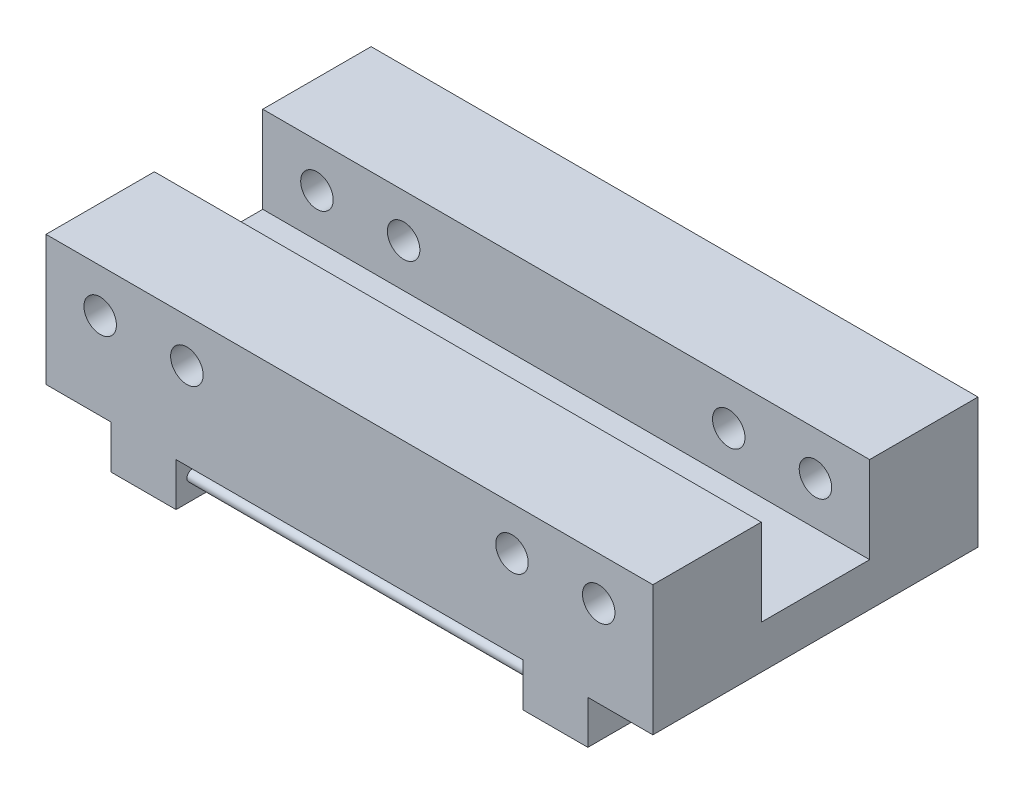
from build123d import *

# Parameters (mm, degrees)
SKETCH1_W                                  = 280
SKETCH1_H                                  = 150
BOSS_EXTRUDE1_DEPTH                        = 20
SKETCH2_W                                  = 30
SKETCH2_H                                  = 30
BOSS_EXTRUDE2_DEPTH                        = 20
MIRROR1_AT_THE_SECOND_PLANE_COPY_1_SKETC_W = 30
MIRROR1_AT_THE_SECOND_PLANE_COPY_1_SKETC_H = 30
MIRROR1_AT_THE_SECOND_PLANE_COPY_1_DEPTH   = 20
SKETCH3_R                                  = 2.5
BOSS_EXTRUDE3_DEPTH                        = 160
SKETCH7_W                                  = 280
SKETCH7_H                                  = 50
BOSS_EXTRUDE5_DEPTH                        = 40
SKETCH8_R                                  = 7.5
CUT_EXTRUDE1_DEPTH                         = 321.156211872


with BuildPart() as part:
    # Sketch1 → Boss-Extrude1 (new body)
    with BuildSketch(Plane(origin=(0, 0, 0), x_dir=(1, 0, 0), z_dir=(0, 1, 0))):
        with Locations((-140, 75)):
            Rectangle(SKETCH1_W, SKETCH1_H)
    extrude(amount=-BOSS_EXTRUDE1_DEPTH)

    # Sketch2 → Boss-Extrude2 (add)
    with BuildSketch(Plane.XZ.offset(20)):
        with Locations((-235, -15)):
            Rectangle(SKETCH2_W, SKETCH2_H)
    boss_extrude2 = extrude(amount=BOSS_EXTRUDE2_DEPTH)

    # Mirror1: Boss-Extrude2 across plane
    add(boss_extrude2.mirror(Plane.ZY.offset(140)))

    # Mirror1 at the second plane: Boss-Extrude2 across plane
    add(boss_extrude2.mirror(Plane(origin=(0, 0, -75), x_dir=(1, 0, 0), z_dir=(0, 0, -1))))

    # Mirror1 at the second plane copy 1 sketc → Mirror1 at the second plane copy 1 (add)
    with BuildSketch(Plane(origin=(-280, -20, -150), x_dir=(-1, 0, 0), z_dir=(0, -1, 0))):
        with Locations((-235, -15)):
            Rectangle(MIRROR1_AT_THE_SECOND_PLANE_COPY_1_SKETC_W, MIRROR1_AT_THE_SECOND_PLANE_COPY_1_SKETC_H)
    extrude(amount=MIRROR1_AT_THE_SECOND_PLANE_COPY_1_DEPTH)

    # Sketch3 → Boss-Extrude3 (add)
    with BuildSketch(Plane(origin=(-220, 0, 0), x_dir=(0, 0, -1), z_dir=(1, 0, 0))):
        with Locations(Location((7.5, -30, 0), (0, 0, 180))):
            Circle(SKETCH3_R)
        with Locations(Location((22.5, -30, 0), (0, 0, 180))):
            Circle(SKETCH3_R)
    boss_extrude3 = extrude(amount=BOSS_EXTRUDE3_DEPTH)

    # Mirror2: Boss-Extrude3 across plane
    add(boss_extrude3.mirror(Plane(origin=(0, 0, -75), x_dir=(1, 0, 0), z_dir=(0, 0, -1))))

    # Sketch7 → Boss-Extrude5 (add)
    with BuildSketch(Plane(origin=(0, 0, 0), x_dir=(1, 0, 0), z_dir=(0, 1, 0))):
        with Locations((-140, 125)):
            Rectangle(SKETCH7_W, SKETCH7_H)
    boss_extrude5 = extrude(amount=BOSS_EXTRUDE5_DEPTH)

    # Mirror4: Boss-Extrude5 across plane
    add(boss_extrude5.mirror(Plane(origin=(0, 0, -75), x_dir=(1, 0, 0), z_dir=(0, 0, -1))))

    # Sketch8 → Cut-Extrude1 (cut, through all)
    with BuildSketch(Plane(origin=(0, 0, -150), x_dir=(-1, 0, 0), z_dir=(0, 0, -1))):
        with Locations((25, 20)):
            Circle(SKETCH8_R)
        with Locations((65, 20)):
            Circle(SKETCH8_R)
        with Locations((215, 20)):
            Circle(SKETCH8_R)
        with Locations((255, 20)):
            Circle(SKETCH8_R)
    extrude(amount=-CUT_EXTRUDE1_DEPTH, mode=Mode.SUBTRACT)


solid = part.part
